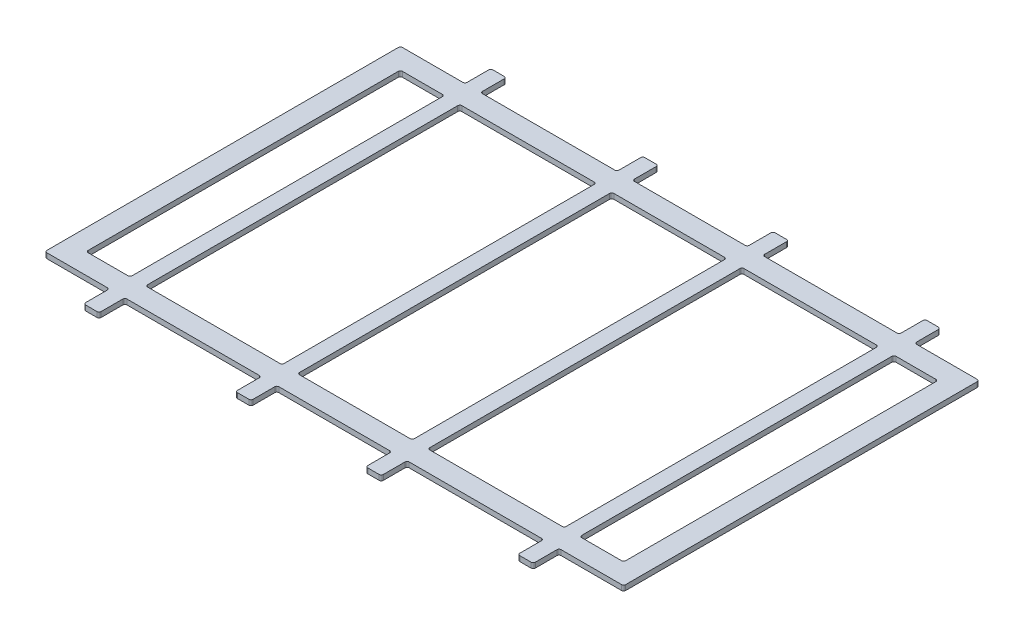
from build123d import *

# Parameters (mm, degrees)
SKETCH1_W               = 560
SKETCH1_H               = 344
BOSS_EXTRUDE1_DEPTH     = 5
SKETCH2_W               = 15
SKETCH2_H               = 25
BOSS_EXTRUDE2_DEPTH     = 5
MIRROR5_COPY_1_SKETCH_W = 15
MIRROR5_COPY_1_SKETCH_H = 25
MIRROR5_COPY_1_DEPTH    = 5
FILLET3_R               = 2
SKETCH3_W               = 42.5
SKETCH3_H               = 304
SKETCH3_W_2             = 132
SKETCH3_W_3             = 55.5
CUT_EXTRUDE1_DEPTH      = 343.394509302
FILLET4_R               = 2


with BuildPart() as part:
    # Sketch1 → Boss-Extrude1 (new body)
    with BuildSketch(Plane(origin=(0, 0, 0), x_dir=(1, 0, 0), z_dir=(0, 1, 0))):
        Rectangle(SKETCH1_W, SKETCH1_H)
    extrude(amount=BOSS_EXTRUDE1_DEPTH)

    # Sketch2 → Boss-Extrude2 (add)
    with BuildSketch(Plane(origin=(0, 5, 0), x_dir=(1, 0, 0), z_dir=(0, 1, 0))):
        with Locations((-63, -184.5)):
            Rectangle(SKETCH2_W, SKETCH2_H)
        with Locations((-210, -184.5)):
            Rectangle(SKETCH2_W, SKETCH2_H)
    boss_extrude2 = extrude(amount=-BOSS_EXTRUDE2_DEPTH)

    # Mirror4: Boss-Extrude2 across plane
    add(boss_extrude2.mirror(Plane(origin=(0, 0, 0), x_dir=(0, 0, 1), z_dir=(1, 0, 0))))

    # Mirror5: Boss-Extrude2 across plane
    add(boss_extrude2.mirror(Plane.XY))

    # Mirror5 copy 1 sketch → Mirror5 copy 1 (add)
    with BuildSketch(Plane(origin=(0, 5, 0), x_dir=(-1, 0, 0), z_dir=(0, 1, 0))):
        with Locations((-63, -184.5)):
            Rectangle(MIRROR5_COPY_1_SKETCH_W, MIRROR5_COPY_1_SKETCH_H)
        with Locations((-210, -184.5)):
            Rectangle(MIRROR5_COPY_1_SKETCH_W, MIRROR5_COPY_1_SKETCH_H)
    extrude(amount=-MIRROR5_COPY_1_DEPTH)

    # Fillet3
    fillet3_edges = [part.edges().sort_by_distance(p)[0] for p in [
        (-70.5, 2.5, 197),
        (-70.5, 2.5, 172),
        (-55.5, 2.5, 172),
        (-55.5, 2.5, 197),
        (-202.5, 2.5, 172),
        (-202.5, 2.5, 197),
        (-217.5, 2.5, 197),
        (-217.5, 2.5, 172),
        (55.5, 2.5, 172),
        (55.5, 2.5, 197),
        (70.5, 2.5, 197),
        (70.5, 2.5, 172),
        (217.5, 2.5, 197),
        (217.5, 2.5, 172),
        (202.5, 2.5, 172),
        (202.5, 2.5, 197),
        (70.5, 2.5, -197),
        (70.5, 2.5, -172),
        (55.5, 2.5, -172),
        (55.5, 2.5, -197),
        (202.5, 2.5, -172),
        (202.5, 2.5, -197),
        (217.5, 2.5, -197),
        (217.5, 2.5, -172),
        (-280, 2.5, -172),
        (280, 2.5, -172),
        (280, 2.5, 172),
        (-280, 2.5, 172),
        (-55.5, 2.5, -172),
        (-55.5, 2.5, -197),
        (-70.5, 2.5, -197),
        (-70.5, 2.5, -172),
        (-217.5, 2.5, -197),
        (-217.5, 2.5, -172),
        (-202.5, 2.5, -172),
        (-202.5, 2.5, -197),
    ]]
    fillet(fillet3_edges, radius=FILLET3_R)

    # Sketch3 → Cut-Extrude1 (cut, through all)
    with BuildSketch(Plane(origin=(0, 5, 0), x_dir=(1, 0, 0), z_dir=(0, 1, 0))):
        with Locations((238.75, 0)):
            Rectangle(SKETCH3_W, SKETCH3_H)
        with Locations((136.5, 0)):
            Rectangle(SKETCH3_W_2, SKETCH3_H)
        with Locations((27.75, 0)):
            Rectangle(SKETCH3_W_3, SKETCH3_H)
    cut_extrude1 = extrude(amount=-CUT_EXTRUDE1_DEPTH, mode=Mode.SUBTRACT)

    # Mirror6: Cut-Extrude1 across plane
    add(cut_extrude1.mirror(Plane(origin=(0, 0, 0), x_dir=(0, 0, 1), z_dir=(1, 0, 0))), mode=Mode.SUBTRACT)

    # Fillet4
    fillet4_edges = [part.edges().sort_by_distance(p)[0] for p in [
        (217.5, 2.5, 152),
        (217.5, 2.5, -152),
        (260, 2.5, -152),
        (260, 2.5, 152),
        (202.5, 2.5, -152),
        (202.5, 2.5, 152),
        (70.5, 2.5, 152),
        (70.5, 2.5, -152),
        (55.5, 2.5, -152),
        (55.5, 2.5, 152),
        (-217.5, 2.5, -152),
        (-217.5, 2.5, 152),
        (-260, 2.5, 152),
        (-260, 2.5, -152),
        (-202.5, 2.5, 152),
        (-202.5, 2.5, -152),
        (-70.5, 2.5, -152),
        (-70.5, 2.5, 152),
        (-55.5, 2.5, 152),
        (-55.5, 2.5, -152),
    ]]
    fillet(fillet4_edges, radius=FILLET4_R)


solid = part.part
